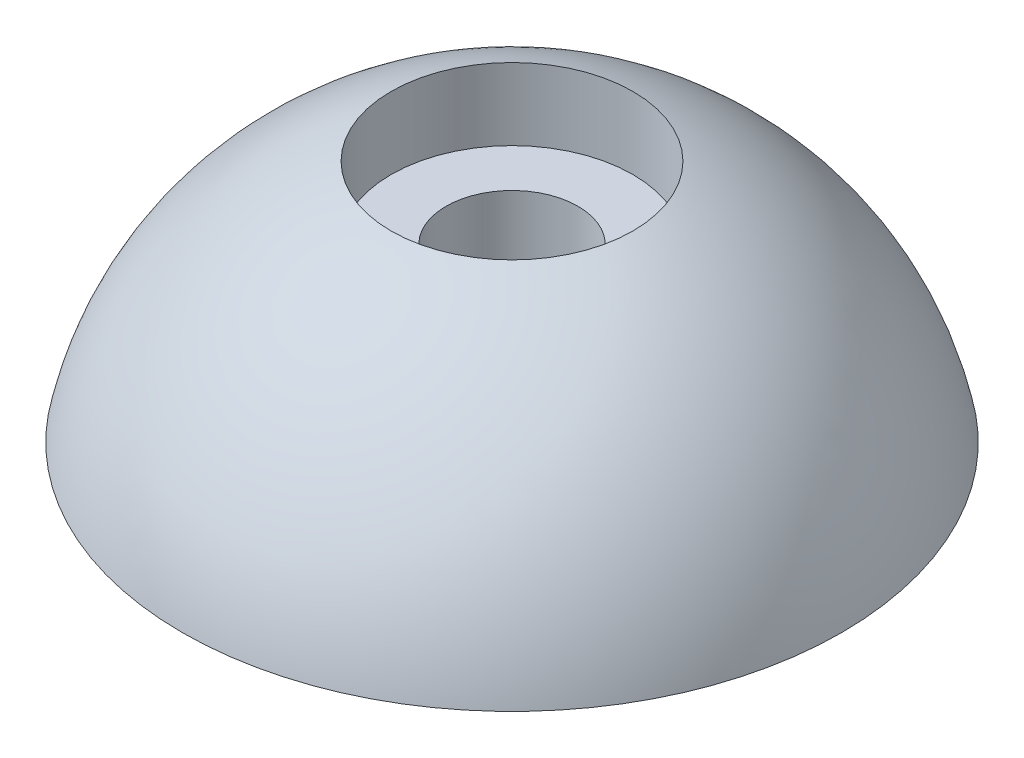
from build123d import *

# Parameters (mm, degrees)
SKETCH2_R          = 1.5
CUT_EXTRUDE1_DEPTH = 13.186808537
SKETCH4_R          = 2.75
CUT_EXTRUDE2_DEPTH = 2.1


with BuildPart() as part:
    # Sketch1 → Revolve1 (revolve)
    with BuildSketch(Plane.XY):
        with BuildLine():
            Line((0, 0), (7.5, 0))
            ThreePointArc((7.5, 0), (4.836432575, 4.358040719), (0, 6))
            Line((0, 6), (0, 0))
        make_face()
    revolve(axis=Axis((0, 0, 0), (0, 1, 0)))

    # Sketch2 → Cut-Extrude1 (cut, through all)
    with BuildSketch(Plane.XZ):
        with Locations(Location((0, 0, 0), (0, 0, 270))):
            Circle(SKETCH2_R)
    extrude(amount=-CUT_EXTRUDE1_DEPTH, mode=Mode.SUBTRACT)

    # Sketch4 → Cut-Extrude2 (cut)
    with BuildSketch(Plane(origin=(0, 6, 0), x_dir=(-1, 0, 0), z_dir=(0, -1, 0))):
        with Locations(Location((0, 0, 0), (0, 0, 90))):
            Circle(SKETCH4_R)
    extrude(amount=CUT_EXTRUDE2_DEPTH, mode=Mode.SUBTRACT)


solid = part.part
